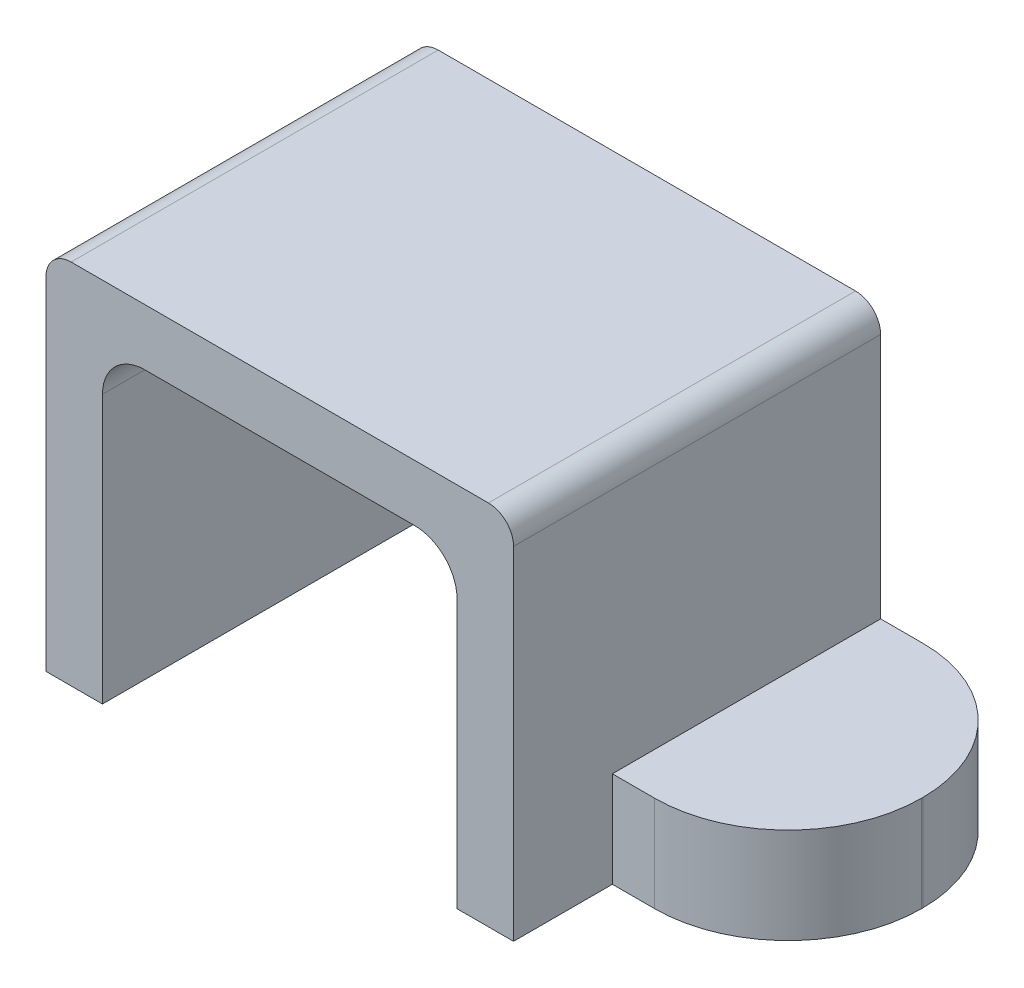
from build123d import *

# Parameters (mm, degrees)
SKICA1_W                 = 14.9
SKICA1_H                 = 11.7
P_IDAT_VYSUNUT_M1_DEPTH  = 11.7
ODEBRAT_VYSUNUT_M2_DEPTH = 2.3
ODEBRAT_VYSUNUT_M3_DEPTH = 20
ZAOBLIT2_R               = 0.8
SKICA9_W                 = 8.55
SKICA9_H                 = 3.05
P_IDAT_VYSUNUT_M3_DEPTH  = 5.6
ZAOBLIT3_R               = 4.25
SKICA10_W                = 8.55
SKICA10_H                = 3.05
P_IDAT_VYSUNUT_M4_DEPTH  = 5.6
ZAOBLIT4_R               = 4.25


with BuildPart() as part:
    # Skica1 → Přidat vysunutím1 (new body)
    with BuildSketch(Plane.XY):
        Rectangle(SKICA1_W, SKICA1_H)
    extrude(amount=P_IDAT_VYSUNUT_M1_DEPTH)

    # Skica2 → Odebrat vysunutím2 (cut)
    with BuildSketch(Plane.XY.offset(11.7)):
        with BuildLine():
            Line((-5.65, -5.85), (5.65, -5.85))
            Line((5.65, -5.85), (5.65, 2.7))
            ThreePointArc((5.65, 2.7), (5.254594155, 3.654594155), (4.3, 4.05))
            Line((4.3, 4.05), (-4.3, 4.05))
            ThreePointArc((-4.3, 4.05), (-5.254594155, 3.654594155), (-5.65, 2.7))
            Line((-5.65, 2.7), (-5.65, -5.85))
        make_face()
    extrude(amount=-ODEBRAT_VYSUNUT_M2_DEPTH, mode=Mode.SUBTRACT)

    # Skica5 → Odebrat vysunutím3 (cut)
    with BuildSketch(Plane.XY.offset(9.4)):
        Polygon((-4.3, 4.05), (4.3, 4.05), (5.65, 4.05), (5.65, -5.85), (-5.65, -5.85), (-5.65, 4.05), align=None)
    extrude(amount=-ODEBRAT_VYSUNUT_M3_DEPTH, mode=Mode.SUBTRACT)

    # Zaoblit2
    zaoblit2_edges = [part.edges().sort_by_distance(p)[0] for p in [
        (-7.45, 5.85, 5.85),
        (7.45, 5.85, 5.85),
    ]]
    fillet(zaoblit2_edges, radius=ZAOBLIT2_R)

    # Skica9 → Přidat vysunutím3 (add)
    with BuildSketch(Plane.ZY.offset(7.45)):
        with Locations((4.275, -4.325)):
            Rectangle(SKICA9_W, SKICA9_H)
    extrude(amount=P_IDAT_VYSUNUT_M3_DEPTH)

    # Zaoblit3
    zaoblit3_edges = [part.edges().sort_by_distance(p)[0] for p in [
        (-13.05, -4.325, 0),
        (-13.05, -4.325, 8.55),
    ]]
    fillet(zaoblit3_edges, radius=ZAOBLIT3_R)

    # Skica10 → Přidat vysunutím4 (add)
    with BuildSketch(Plane(origin=(7.45, 0, 0), x_dir=(0, 0, -1), z_dir=(1, 0, 0))):
        with Locations((-4.275, -4.325)):
            Rectangle(SKICA10_W, SKICA10_H)
    extrude(amount=P_IDAT_VYSUNUT_M4_DEPTH)

    # Zaoblit4
    zaoblit4_edges = [part.edges().sort_by_distance(p)[0] for p in [
        (13.05, -4.325, 8.55),
        (13.05, -4.325, 0),
    ]]
    fillet(zaoblit4_edges, radius=ZAOBLIT4_R)


solid = part.part
